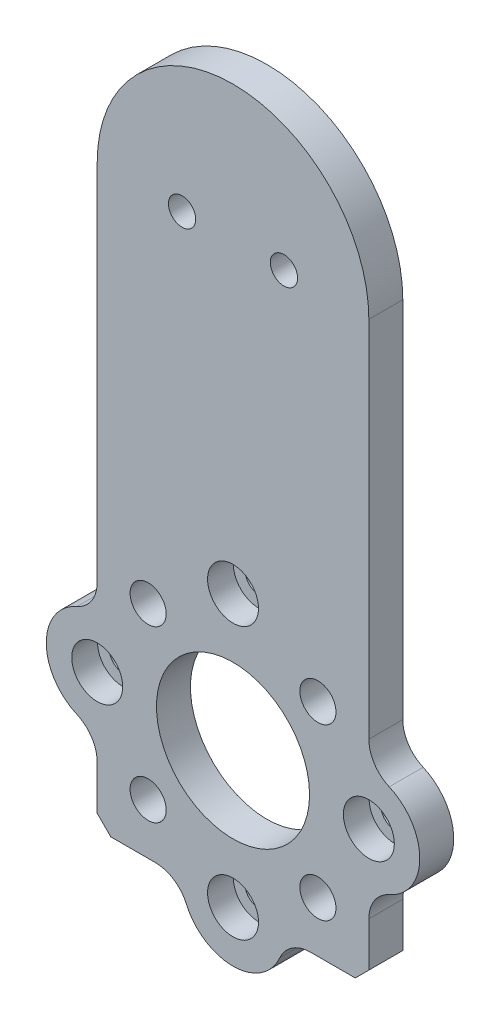
from build123d import *

# Parameters (mm, degrees)
SKETCH1_R                                       = 3.3782
SKETCH1_R_2                                     = 14.3129
BOSS_EXTRUDE1_DEPTH                             = 6.35
CBORE_FOR_10_SOCKET_HEAD_CAP_SCREW1_D           = 5.1054
CBORE_FOR_10_SOCKET_HEAD_CAP_SCREW1_CBORE_D     = 9.525
CBORE_FOR_10_SOCKET_HEAD_CAP_SCREW1_CBORE_DEPTH = 4.826
F_1_4_20_TAPPED_HOLE2_D                         = 5.1054
FILLET1_R                                       = 6.35
CHAMFER1_SIZE                                   = 2.54


with BuildPart() as part:
    # Sketch1 → Boss-Extrude1 (new body)
    with BuildSketch(Plane.XY):
        with BuildLine():
            Line((0, 0), (15.875, 0))
            ThreePointArc((15.875, 0), (25.4, -9.525), (34.925, 0))
            Line((34.925, 0), (50.8, 0))
            Line((50.8, 0), (50.8, 15.875))
            ThreePointArc((50.8, 15.875), (60.325, 25.4), (50.8, 34.925))
            Line((50.8, 34.925), (50.8, 107.95))
            ThreePointArc((50.8, 107.95), (25.4, 133.35), (0, 107.95))
            Line((0, 107.95), (0, 34.925))
            ThreePointArc((0, 34.925), (-9.525, 25.4), (0, 15.875))
            Line((0, 15.875), (0, 0))
        make_face()
        with Locations((41.275, 9.525)):
            Circle(SKETCH1_R, mode=Mode.SUBTRACT)
        with Locations((9.525, 9.525)):
            Circle(SKETCH1_R, mode=Mode.SUBTRACT)
        with Locations((9.525, 41.275)):
            Circle(SKETCH1_R, mode=Mode.SUBTRACT)
        with Locations((41.275, 41.275)):
            Circle(SKETCH1_R, mode=Mode.SUBTRACT)
        with Locations((25.4, 25.4)):
            Circle(SKETCH1_R_2, mode=Mode.SUBTRACT)
    extrude(amount=BOSS_EXTRUDE1_DEPTH)

    # CBORE for #10 Socket Head Cap Screw1 (through all)
    with Locations(Plane.XY.offset(6.35)):
        with Locations((0, 25.4), (50.8, 25.4), (25.4, 0), (25.4, 50.8)):
            CounterBoreHole(CBORE_FOR_10_SOCKET_HEAD_CAP_SCREW1_D / 2, CBORE_FOR_10_SOCKET_HEAD_CAP_SCREW1_CBORE_D / 2, CBORE_FOR_10_SOCKET_HEAD_CAP_SCREW1_CBORE_DEPTH)

    # 1/4-20 Tapped Hole2 (through all)
    with Locations(Plane(origin=(0, 0, 0), x_dir=(1, 0, 0), z_dir=(0, 0, -1))):
        with Locations((15.875, -107.95), (34.925, -107.95)):
            Hole(F_1_4_20_TAPPED_HOLE2_D / 2)

    # Fillet1
    fillet1_edges = [part.edges().sort_by_distance(p)[0] for p in [
        (0, 15.875, 3.175),
        (0, 34.925, 3.175),
        (50.8, 34.925, 3.175),
        (50.8, 15.875, 3.175),
        (34.925, 0, 3.175),
        (15.875, 0, 3.175),
    ]]
    fillet(fillet1_edges, radius=FILLET1_R)

    # Chamfer1
    chamfer1_edges = [part.edges().sort_by_distance(p)[0] for p in [
        (50.8, 0, 3.175),
        (0, 0, 3.175),
    ]]
    chamfer(chamfer1_edges, length=CHAMFER1_SIZE)


solid = part.part
